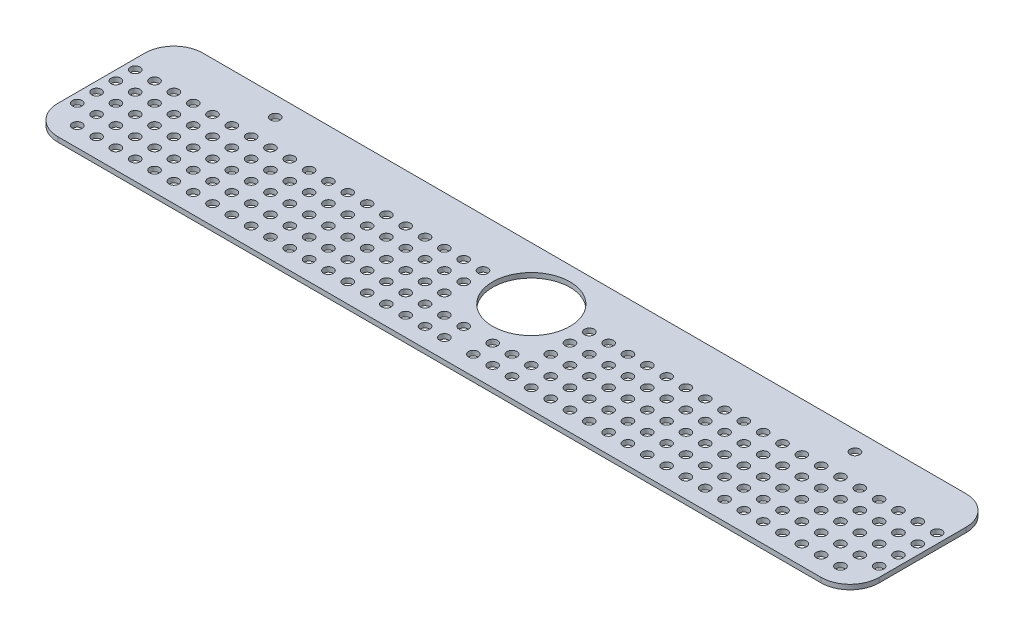
from build123d import *

# Parameters (mm, degrees)
SKETCH1_R           = 40
SKETCH1_R_2         = 5
BOSS_EXTRUDE1_DEPTH = 5


with BuildPart() as part:
    # Sketch1 → Boss-Extrude1 (new body)
    with BuildSketch(Plane(origin=(0, 0, 0), x_dir=(1, 0, 0), z_dir=(0, 1, 0))):
        with BuildLine():
            Line((395, -75), (-395, -75))
            ThreePointArc((-395, -75), (-416.213203436, -66.213203436), (-425, -45))
            Line((-425, -45), (-425, 45))
            ThreePointArc((-425, 45), (-416.213203436, 66.213203436), (-395, 75))
            Line((-395, 75), (395, 75))
            ThreePointArc((395, 75), (416.213203436, 66.213203436), (425, 45))
            Line((425, 45), (425, -45))
            ThreePointArc((425, -45), (416.213203436, -66.213203436), (395, -75))
        make_face()
        with Locations(Location((0, 20, 0), (0, 0, 270))):
            Circle(SKETCH1_R, mode=Mode.SUBTRACT)
        with Locations(Location((-300, 55, 0), (0, 0, 270))):
            Circle(SKETCH1_R_2, mode=Mode.SUBTRACT)
        with Locations(Location((300, 55, 0), (0, 0, 270))):
            Circle(SKETCH1_R_2, mode=Mode.SUBTRACT)
        with Locations(Location((-415, 25, 0), (0, 0, 270))):
            Circle(SKETCH1_R_2, mode=Mode.SUBTRACT)
        with Locations(Location((-395, 25, 0), (0, 0, 270))):
            Circle(SKETCH1_R_2, mode=Mode.SUBTRACT)
        with Locations(Location((-375, 25, 0), (0, 0, 270))):
            Circle(SKETCH1_R_2, mode=Mode.SUBTRACT)
        with Locations(Location((-355, 25, 0), (0, 0, 270))):
            Circle(SKETCH1_R_2, mode=Mode.SUBTRACT)
        with Locations(Location((-335, 25, 0), (0, 0, 270))):
            Circle(SKETCH1_R_2, mode=Mode.SUBTRACT)
        with Locations(Location((-315, 25, 0), (0, 0, 270))):
            Circle(SKETCH1_R_2, mode=Mode.SUBTRACT)
        with Locations(Location((-295, 25, 0), (0, 0, 270))):
            Circle(SKETCH1_R_2, mode=Mode.SUBTRACT)
        with Locations(Location((-275, 25, 0), (0, 0, 270))):
            Circle(SKETCH1_R_2, mode=Mode.SUBTRACT)
        with Locations(Location((-255, 25, 0), (0, 0, 270))):
            Circle(SKETCH1_R_2, mode=Mode.SUBTRACT)
        with Locations(Location((-235, 25, 0), (0, 0, 270))):
            Circle(SKETCH1_R_2, mode=Mode.SUBTRACT)
        with Locations(Location((-415, 5, 0), (0, 0, 270))):
            Circle(SKETCH1_R_2, mode=Mode.SUBTRACT)
        with Locations(Location((-395, 5, 0), (0, 0, 270))):
            Circle(SKETCH1_R_2, mode=Mode.SUBTRACT)
        with Locations(Location((-375, 5, 0), (0, 0, 270))):
            Circle(SKETCH1_R_2, mode=Mode.SUBTRACT)
        with Locations(Location((-355, 5, 0), (0, 0, 270))):
            Circle(SKETCH1_R_2, mode=Mode.SUBTRACT)
        with Locations(Location((-335, 5, 0), (0, 0, 270))):
            Circle(SKETCH1_R_2, mode=Mode.SUBTRACT)
        with Locations(Location((-315, 5, 0), (0, 0, 270))):
            Circle(SKETCH1_R_2, mode=Mode.SUBTRACT)
        with Locations(Location((-295, 5, 0), (0, 0, 270))):
            Circle(SKETCH1_R_2, mode=Mode.SUBTRACT)
        with Locations(Location((-275, 5, 0), (0, 0, 270))):
            Circle(SKETCH1_R_2, mode=Mode.SUBTRACT)
        with Locations(Location((-255, 5, 0), (0, 0, 270))):
            Circle(SKETCH1_R_2, mode=Mode.SUBTRACT)
        with Locations(Location((-235, 5, 0), (0, 0, 270))):
            Circle(SKETCH1_R_2, mode=Mode.SUBTRACT)
        with Locations(Location((-415, -15, 0), (0, 0, 270))):
            Circle(SKETCH1_R_2, mode=Mode.SUBTRACT)
        with Locations(Location((-395, -15, 0), (0, 0, 270))):
            Circle(SKETCH1_R_2, mode=Mode.SUBTRACT)
        with Locations(Location((-375, -15, 0), (0, 0, 270))):
            Circle(SKETCH1_R_2, mode=Mode.SUBTRACT)
        with Locations(Location((-355, -15, 0), (0, 0, 270))):
            Circle(SKETCH1_R_2, mode=Mode.SUBTRACT)
        with Locations(Location((-335, -15, 0), (0, 0, 270))):
            Circle(SKETCH1_R_2, mode=Mode.SUBTRACT)
        with Locations(Location((-315, -15, 0), (0, 0, 270))):
            Circle(SKETCH1_R_2, mode=Mode.SUBTRACT)
        with Locations(Location((-295, -15, 0), (0, 0, 270))):
            Circle(SKETCH1_R_2, mode=Mode.SUBTRACT)
        with Locations(Location((-275, -15, 0), (0, 0, 270))):
            Circle(SKETCH1_R_2, mode=Mode.SUBTRACT)
        with Locations(Location((-255, -15, 0), (0, 0, 270))):
            Circle(SKETCH1_R_2, mode=Mode.SUBTRACT)
        with Locations(Location((-235, -15, 0), (0, 0, 270))):
            Circle(SKETCH1_R_2, mode=Mode.SUBTRACT)
        with Locations(Location((-415, -35, 0), (0, 0, 270))):
            Circle(SKETCH1_R_2, mode=Mode.SUBTRACT)
        with Locations(Location((-395, -35, 0), (0, 0, 270))):
            Circle(SKETCH1_R_2, mode=Mode.SUBTRACT)
        with Locations(Location((-375, -35, 0), (0, 0, 270))):
            Circle(SKETCH1_R_2, mode=Mode.SUBTRACT)
        with Locations(Location((-355, -35, 0), (0, 0, 270))):
            Circle(SKETCH1_R_2, mode=Mode.SUBTRACT)
        with Locations(Location((-335, -35, 0), (0, 0, 270))):
            Circle(SKETCH1_R_2, mode=Mode.SUBTRACT)
        with Locations(Location((-315, -35, 0), (0, 0, 270))):
            Circle(SKETCH1_R_2, mode=Mode.SUBTRACT)
        with Locations(Location((-295, -35, 0), (0, 0, 270))):
            Circle(SKETCH1_R_2, mode=Mode.SUBTRACT)
        with Locations(Location((-275, -35, 0), (0, 0, 270))):
            Circle(SKETCH1_R_2, mode=Mode.SUBTRACT)
        with Locations(Location((-255, -35, 0), (0, 0, 270))):
            Circle(SKETCH1_R_2, mode=Mode.SUBTRACT)
        with Locations(Location((-235, -35, 0), (0, 0, 270))):
            Circle(SKETCH1_R_2, mode=Mode.SUBTRACT)
        with Locations(Location((-395, -55, 0), (0, 0, 270))):
            Circle(SKETCH1_R_2, mode=Mode.SUBTRACT)
        with Locations(Location((-375, -55, 0), (0, 0, 270))):
            Circle(SKETCH1_R_2, mode=Mode.SUBTRACT)
        with Locations(Location((-355, -55, 0), (0, 0, 270))):
            Circle(SKETCH1_R_2, mode=Mode.SUBTRACT)
        with Locations(Location((-335, -55, 0), (0, 0, 270))):
            Circle(SKETCH1_R_2, mode=Mode.SUBTRACT)
        with Locations(Location((-315, -55, 0), (0, 0, 270))):
            Circle(SKETCH1_R_2, mode=Mode.SUBTRACT)
        with Locations(Location((-295, -55, 0), (0, 0, 270))):
            Circle(SKETCH1_R_2, mode=Mode.SUBTRACT)
        with Locations(Location((-275, -55, 0), (0, 0, 270))):
            Circle(SKETCH1_R_2, mode=Mode.SUBTRACT)
        with Locations(Location((-255, -55, 0), (0, 0, 270))):
            Circle(SKETCH1_R_2, mode=Mode.SUBTRACT)
        with Locations(Location((-235, -55, 0), (0, 0, 270))):
            Circle(SKETCH1_R_2, mode=Mode.SUBTRACT)
        with Locations(Location((-215, -35, 0), (0, 0, 270))):
            Circle(SKETCH1_R_2, mode=Mode.SUBTRACT)
        with Locations(Location((-215, -55, 0), (0, 0, 270))):
            Circle(SKETCH1_R_2, mode=Mode.SUBTRACT)
        with Locations(Location((-195, -35, 0), (0, 0, 270))):
            Circle(SKETCH1_R_2, mode=Mode.SUBTRACT)
        with Locations(Location((-195, -55, 0), (0, 0, 270))):
            Circle(SKETCH1_R_2, mode=Mode.SUBTRACT)
        with Locations(Location((195, -55, 0), (0, 0, 270))):
            Circle(SKETCH1_R_2, mode=Mode.SUBTRACT)
        with Locations(Location((215, -55, 0), (0, 0, 270))):
            Circle(SKETCH1_R_2, mode=Mode.SUBTRACT)
        with Locations(Location((235, -55, 0), (0, 0, 270))):
            Circle(SKETCH1_R_2, mode=Mode.SUBTRACT)
        with Locations(Location((255, -55, 0), (0, 0, 270))):
            Circle(SKETCH1_R_2, mode=Mode.SUBTRACT)
        with Locations(Location((275, -55, 0), (0, 0, 270))):
            Circle(SKETCH1_R_2, mode=Mode.SUBTRACT)
        with Locations(Location((295, -55, 0), (0, 0, 270))):
            Circle(SKETCH1_R_2, mode=Mode.SUBTRACT)
        with Locations(Location((315, -55, 0), (0, 0, 270))):
            Circle(SKETCH1_R_2, mode=Mode.SUBTRACT)
        with Locations(Location((295, -35, 0), (0, 0, 270))):
            Circle(SKETCH1_R_2, mode=Mode.SUBTRACT)
        with Locations(Location((275, -35, 0), (0, 0, 270))):
            Circle(SKETCH1_R_2, mode=Mode.SUBTRACT)
        with Locations(Location((255, -35, 0), (0, 0, 270))):
            Circle(SKETCH1_R_2, mode=Mode.SUBTRACT)
        with Locations(Location((235, -35, 0), (0, 0, 270))):
            Circle(SKETCH1_R_2, mode=Mode.SUBTRACT)
        with Locations(Location((195, -35, 0), (0, 0, 270))):
            Circle(SKETCH1_R_2, mode=Mode.SUBTRACT)
        with Locations(Location((215, -35, 0), (0, 0, 270))):
            Circle(SKETCH1_R_2, mode=Mode.SUBTRACT)
        with Locations(Location((235, -15, 0), (0, 0, 270))):
            Circle(SKETCH1_R_2, mode=Mode.SUBTRACT)
        with Locations(Location((255, -15, 0), (0, 0, 270))):
            Circle(SKETCH1_R_2, mode=Mode.SUBTRACT)
        with Locations(Location((275, -15, 0), (0, 0, 270))):
            Circle(SKETCH1_R_2, mode=Mode.SUBTRACT)
        with Locations(Location((295, -15, 0), (0, 0, 270))):
            Circle(SKETCH1_R_2, mode=Mode.SUBTRACT)
        with Locations(Location((295, 5, 0), (0, 0, 270))):
            Circle(SKETCH1_R_2, mode=Mode.SUBTRACT)
        with Locations(Location((275, 5, 0), (0, 0, 270))):
            Circle(SKETCH1_R_2, mode=Mode.SUBTRACT)
        with Locations(Location((255, 5, 0), (0, 0, 270))):
            Circle(SKETCH1_R_2, mode=Mode.SUBTRACT)
        with Locations(Location((235, 5, 0), (0, 0, 270))):
            Circle(SKETCH1_R_2, mode=Mode.SUBTRACT)
        with Locations(Location((235, 25, 0), (0, 0, 270))):
            Circle(SKETCH1_R_2, mode=Mode.SUBTRACT)
        with Locations(Location((255, 25, 0), (0, 0, 270))):
            Circle(SKETCH1_R_2, mode=Mode.SUBTRACT)
        with Locations(Location((275, 25, 0), (0, 0, 270))):
            Circle(SKETCH1_R_2, mode=Mode.SUBTRACT)
        with Locations(Location((295, 25, 0), (0, 0, 270))):
            Circle(SKETCH1_R_2, mode=Mode.SUBTRACT)
        with Locations(Location((315, 25, 0), (0, 0, 270))):
            Circle(SKETCH1_R_2, mode=Mode.SUBTRACT)
        with Locations(Location((315, 5, 0), (0, 0, 270))):
            Circle(SKETCH1_R_2, mode=Mode.SUBTRACT)
        with Locations(Location((315, -15, 0), (0, 0, 270))):
            Circle(SKETCH1_R_2, mode=Mode.SUBTRACT)
        with Locations(Location((315, -35, 0), (0, 0, 270))):
            Circle(SKETCH1_R_2, mode=Mode.SUBTRACT)
        with Locations(Location((335, -55, 0), (0, 0, 270))):
            Circle(SKETCH1_R_2, mode=Mode.SUBTRACT)
        with Locations(Location((335, 5, 0), (0, 0, 270))):
            Circle(SKETCH1_R_2, mode=Mode.SUBTRACT)
        with Locations(Location((335, -15, 0), (0, 0, 270))):
            Circle(SKETCH1_R_2, mode=Mode.SUBTRACT)
        with Locations(Location((335, -35, 0), (0, 0, 270))):
            Circle(SKETCH1_R_2, mode=Mode.SUBTRACT)
        with Locations(Location((355, -55, 0), (0, 0, 270))):
            Circle(SKETCH1_R_2, mode=Mode.SUBTRACT)
        with Locations(Location((355, -35, 0), (0, 0, 270))):
            Circle(SKETCH1_R_2, mode=Mode.SUBTRACT)
        with Locations(Location((355, -15, 0), (0, 0, 270))):
            Circle(SKETCH1_R_2, mode=Mode.SUBTRACT)
        with Locations(Location((355, 5, 0), (0, 0, 270))):
            Circle(SKETCH1_R_2, mode=Mode.SUBTRACT)
        with Locations(Location((335, 25, 0), (0, 0, 270))):
            Circle(SKETCH1_R_2, mode=Mode.SUBTRACT)
        with Locations(Location((355, 25, 0), (0, 0, 270))):
            Circle(SKETCH1_R_2, mode=Mode.SUBTRACT)
        with Locations(Location((375, -55, 0), (0, 0, 270))):
            Circle(SKETCH1_R_2, mode=Mode.SUBTRACT)
        with Locations(Location((375, -15, 0), (0, 0, 270))):
            Circle(SKETCH1_R_2, mode=Mode.SUBTRACT)
        with Locations(Location((375, -35, 0), (0, 0, 270))):
            Circle(SKETCH1_R_2, mode=Mode.SUBTRACT)
        with Locations(Location((395, -55, 0), (0, 0, 270))):
            Circle(SKETCH1_R_2, mode=Mode.SUBTRACT)
        with Locations(Location((395, -35, 0), (0, 0, 270))):
            Circle(SKETCH1_R_2, mode=Mode.SUBTRACT)
        with Locations(Location((395, -15, 0), (0, 0, 270))):
            Circle(SKETCH1_R_2, mode=Mode.SUBTRACT)
        with Locations(Location((415, -35, 0), (0, 0, 270))):
            Circle(SKETCH1_R_2, mode=Mode.SUBTRACT)
        with Locations(Location((415, -15, 0), (0, 0, 270))):
            Circle(SKETCH1_R_2, mode=Mode.SUBTRACT)
        with Locations(Location((415, 5, 0), (0, 0, 270))):
            Circle(SKETCH1_R_2, mode=Mode.SUBTRACT)
        with Locations(Location((395, 5, 0), (0, 0, 270))):
            Circle(SKETCH1_R_2, mode=Mode.SUBTRACT)
        with Locations(Location((375, 5, 0), (0, 0, 270))):
            Circle(SKETCH1_R_2, mode=Mode.SUBTRACT)
        with Locations(Location((375, 25, 0), (0, 0, 270))):
            Circle(SKETCH1_R_2, mode=Mode.SUBTRACT)
        with Locations(Location((395, 25, 0), (0, 0, 270))):
            Circle(SKETCH1_R_2, mode=Mode.SUBTRACT)
        with Locations(Location((415, 25, 0), (0, 0, 270))):
            Circle(SKETCH1_R_2, mode=Mode.SUBTRACT)
        with Locations(Location((-215, 25, 0), (0, 0, 270))):
            Circle(SKETCH1_R_2, mode=Mode.SUBTRACT)
        with Locations(Location((-215, 5, 0), (0, 0, 270))):
            Circle(SKETCH1_R_2, mode=Mode.SUBTRACT)
        with Locations(Location((-215, -15, 0), (0, 0, 270))):
            Circle(SKETCH1_R_2, mode=Mode.SUBTRACT)
        with Locations(Location((-175, -35, 0), (0, 0, 270))):
            Circle(SKETCH1_R_2, mode=Mode.SUBTRACT)
        with Locations(Location((-175, -55, 0), (0, 0, 270))):
            Circle(SKETCH1_R_2, mode=Mode.SUBTRACT)
        with Locations(Location((-195, 25, 0), (0, 0, 270))):
            Circle(SKETCH1_R_2, mode=Mode.SUBTRACT)
        with Locations(Location((-195, 5, 0), (0, 0, 270))):
            Circle(SKETCH1_R_2, mode=Mode.SUBTRACT)
        with Locations(Location((-195, -15, 0), (0, 0, 270))):
            Circle(SKETCH1_R_2, mode=Mode.SUBTRACT)
        with Locations(Location((-155, -35, 0), (0, 0, 270))):
            Circle(SKETCH1_R_2, mode=Mode.SUBTRACT)
        with Locations(Location((-155, -55, 0), (0, 0, 270))):
            Circle(SKETCH1_R_2, mode=Mode.SUBTRACT)
        with Locations(Location((-175, 25, 0), (0, 0, 270))):
            Circle(SKETCH1_R_2, mode=Mode.SUBTRACT)
        with Locations(Location((-175, 5, 0), (0, 0, 270))):
            Circle(SKETCH1_R_2, mode=Mode.SUBTRACT)
        with Locations(Location((-175, -15, 0), (0, 0, 270))):
            Circle(SKETCH1_R_2, mode=Mode.SUBTRACT)
        with Locations(Location((-135, -35, 0), (0, 0, 270))):
            Circle(SKETCH1_R_2, mode=Mode.SUBTRACT)
        with Locations(Location((-135, -55, 0), (0, 0, 270))):
            Circle(SKETCH1_R_2, mode=Mode.SUBTRACT)
        with Locations(Location((-155, 25, 0), (0, 0, 270))):
            Circle(SKETCH1_R_2, mode=Mode.SUBTRACT)
        with Locations(Location((-155, 5, 0), (0, 0, 270))):
            Circle(SKETCH1_R_2, mode=Mode.SUBTRACT)
        with Locations(Location((-155, -15, 0), (0, 0, 270))):
            Circle(SKETCH1_R_2, mode=Mode.SUBTRACT)
        with Locations(Location((-115, -35, 0), (0, 0, 270))):
            Circle(SKETCH1_R_2, mode=Mode.SUBTRACT)
        with Locations(Location((-115, -55, 0), (0, 0, 270))):
            Circle(SKETCH1_R_2, mode=Mode.SUBTRACT)
        with Locations(Location((-135, 25, 0), (0, 0, 270))):
            Circle(SKETCH1_R_2, mode=Mode.SUBTRACT)
        with Locations(Location((-135, 5, 0), (0, 0, 270))):
            Circle(SKETCH1_R_2, mode=Mode.SUBTRACT)
        with Locations(Location((-135, -15, 0), (0, 0, 270))):
            Circle(SKETCH1_R_2, mode=Mode.SUBTRACT)
        with Locations(Location((-95, -35, 0), (0, 0, 270))):
            Circle(SKETCH1_R_2, mode=Mode.SUBTRACT)
        with Locations(Location((-95, -55, 0), (0, 0, 270))):
            Circle(SKETCH1_R_2, mode=Mode.SUBTRACT)
        with Locations(Location((-115, 25, 0), (0, 0, 270))):
            Circle(SKETCH1_R_2, mode=Mode.SUBTRACT)
        with Locations(Location((-115, 5, 0), (0, 0, 270))):
            Circle(SKETCH1_R_2, mode=Mode.SUBTRACT)
        with Locations(Location((-115, -15, 0), (0, 0, 270))):
            Circle(SKETCH1_R_2, mode=Mode.SUBTRACT)
        with Locations(Location((-75, -35, 0), (0, 0, 270))):
            Circle(SKETCH1_R_2, mode=Mode.SUBTRACT)
        with Locations(Location((-75, -55, 0), (0, 0, 270))):
            Circle(SKETCH1_R_2, mode=Mode.SUBTRACT)
        with Locations(Location((-95, 25, 0), (0, 0, 270))):
            Circle(SKETCH1_R_2, mode=Mode.SUBTRACT)
        with Locations(Location((-95, 5, 0), (0, 0, 270))):
            Circle(SKETCH1_R_2, mode=Mode.SUBTRACT)
        with Locations(Location((-95, -15, 0), (0, 0, 270))):
            Circle(SKETCH1_R_2, mode=Mode.SUBTRACT)
        with Locations(Location((-55, -35, 0), (0, 0, 270))):
            Circle(SKETCH1_R_2, mode=Mode.SUBTRACT)
        with Locations(Location((-55, -55, 0), (0, 0, 270))):
            Circle(SKETCH1_R_2, mode=Mode.SUBTRACT)
        with Locations(Location((-75, 25, 0), (0, 0, 270))):
            Circle(SKETCH1_R_2, mode=Mode.SUBTRACT)
        with Locations(Location((-75, 5, 0), (0, 0, 270))):
            Circle(SKETCH1_R_2, mode=Mode.SUBTRACT)
        with Locations(Location((-75, -15, 0), (0, 0, 270))):
            Circle(SKETCH1_R_2, mode=Mode.SUBTRACT)
        with Locations(Location((-35, -35, 0), (0, 0, 270))):
            Circle(SKETCH1_R_2, mode=Mode.SUBTRACT)
        with Locations(Location((-35, -55, 0), (0, 0, 270))):
            Circle(SKETCH1_R_2, mode=Mode.SUBTRACT)
        with Locations(Location((-55, 25, 0), (0, 0, 270))):
            Circle(SKETCH1_R_2, mode=Mode.SUBTRACT)
        with Locations(Location((-55, 5, 0), (0, 0, 270))):
            Circle(SKETCH1_R_2, mode=Mode.SUBTRACT)
        with Locations(Location((-55, -15, 0), (0, 0, 270))):
            Circle(SKETCH1_R_2, mode=Mode.SUBTRACT)
        with Locations(Location((-15, -35, 0), (0, 0, 270))):
            Circle(SKETCH1_R_2, mode=Mode.SUBTRACT)
        with Locations(Location((-15, -55, 0), (0, 0, 270))):
            Circle(SKETCH1_R_2, mode=Mode.SUBTRACT)
        with Locations(Location((215, 25, 0), (0, 0, 270))):
            Circle(SKETCH1_R_2, mode=Mode.SUBTRACT)
        with Locations(Location((215, 5, 0), (0, 0, 270))):
            Circle(SKETCH1_R_2, mode=Mode.SUBTRACT)
        with Locations(Location((215, -15, 0), (0, 0, 270))):
            Circle(SKETCH1_R_2, mode=Mode.SUBTRACT)
        with Locations(Location((175, -35, 0), (0, 0, 270))):
            Circle(SKETCH1_R_2, mode=Mode.SUBTRACT)
        with Locations(Location((175, -55, 0), (0, 0, 270))):
            Circle(SKETCH1_R_2, mode=Mode.SUBTRACT)
        with Locations(Location((195, 25, 0), (0, 0, 270))):
            Circle(SKETCH1_R_2, mode=Mode.SUBTRACT)
        with Locations(Location((195, 5, 0), (0, 0, 270))):
            Circle(SKETCH1_R_2, mode=Mode.SUBTRACT)
        with Locations(Location((195, -15, 0), (0, 0, 270))):
            Circle(SKETCH1_R_2, mode=Mode.SUBTRACT)
        with Locations(Location((155, -35, 0), (0, 0, 270))):
            Circle(SKETCH1_R_2, mode=Mode.SUBTRACT)
        with Locations(Location((155, -55, 0), (0, 0, 270))):
            Circle(SKETCH1_R_2, mode=Mode.SUBTRACT)
        with Locations(Location((175, 25, 0), (0, 0, 270))):
            Circle(SKETCH1_R_2, mode=Mode.SUBTRACT)
        with Locations(Location((175, 5, 0), (0, 0, 270))):
            Circle(SKETCH1_R_2, mode=Mode.SUBTRACT)
        with Locations(Location((175, -15, 0), (0, 0, 270))):
            Circle(SKETCH1_R_2, mode=Mode.SUBTRACT)
        with Locations(Location((135, -35, 0), (0, 0, 270))):
            Circle(SKETCH1_R_2, mode=Mode.SUBTRACT)
        with Locations(Location((135, -55, 0), (0, 0, 270))):
            Circle(SKETCH1_R_2, mode=Mode.SUBTRACT)
        with Locations(Location((155, 25, 0), (0, 0, 270))):
            Circle(SKETCH1_R_2, mode=Mode.SUBTRACT)
        with Locations(Location((155, 5, 0), (0, 0, 270))):
            Circle(SKETCH1_R_2, mode=Mode.SUBTRACT)
        with Locations(Location((155, -15, 0), (0, 0, 270))):
            Circle(SKETCH1_R_2, mode=Mode.SUBTRACT)
        with Locations(Location((115, -35, 0), (0, 0, 270))):
            Circle(SKETCH1_R_2, mode=Mode.SUBTRACT)
        with Locations(Location((115, -55, 0), (0, 0, 270))):
            Circle(SKETCH1_R_2, mode=Mode.SUBTRACT)
        with Locations(Location((135, 25, 0), (0, 0, 270))):
            Circle(SKETCH1_R_2, mode=Mode.SUBTRACT)
        with Locations(Location((135, 5, 0), (0, 0, 270))):
            Circle(SKETCH1_R_2, mode=Mode.SUBTRACT)
        with Locations(Location((135, -15, 0), (0, 0, 270))):
            Circle(SKETCH1_R_2, mode=Mode.SUBTRACT)
        with Locations(Location((95, -35, 0), (0, 0, 270))):
            Circle(SKETCH1_R_2, mode=Mode.SUBTRACT)
        with Locations(Location((95, -55, 0), (0, 0, 270))):
            Circle(SKETCH1_R_2, mode=Mode.SUBTRACT)
        with Locations(Location((115, 25, 0), (0, 0, 270))):
            Circle(SKETCH1_R_2, mode=Mode.SUBTRACT)
        with Locations(Location((115, 5, 0), (0, 0, 270))):
            Circle(SKETCH1_R_2, mode=Mode.SUBTRACT)
        with Locations(Location((115, -15, 0), (0, 0, 270))):
            Circle(SKETCH1_R_2, mode=Mode.SUBTRACT)
        with Locations(Location((75, -35, 0), (0, 0, 270))):
            Circle(SKETCH1_R_2, mode=Mode.SUBTRACT)
        with Locations(Location((75, -55, 0), (0, 0, 270))):
            Circle(SKETCH1_R_2, mode=Mode.SUBTRACT)
        with Locations(Location((95, 25, 0), (0, 0, 270))):
            Circle(SKETCH1_R_2, mode=Mode.SUBTRACT)
        with Locations(Location((95, 5, 0), (0, 0, 270))):
            Circle(SKETCH1_R_2, mode=Mode.SUBTRACT)
        with Locations(Location((95, -15, 0), (0, 0, 270))):
            Circle(SKETCH1_R_2, mode=Mode.SUBTRACT)
        with Locations(Location((55, -35, 0), (0, 0, 270))):
            Circle(SKETCH1_R_2, mode=Mode.SUBTRACT)
        with Locations(Location((55, -55, 0), (0, 0, 270))):
            Circle(SKETCH1_R_2, mode=Mode.SUBTRACT)
        with Locations(Location((75, 25, 0), (0, 0, 270))):
            Circle(SKETCH1_R_2, mode=Mode.SUBTRACT)
        with Locations(Location((75, 5, 0), (0, 0, 270))):
            Circle(SKETCH1_R_2, mode=Mode.SUBTRACT)
        with Locations(Location((75, -15, 0), (0, 0, 270))):
            Circle(SKETCH1_R_2, mode=Mode.SUBTRACT)
        with Locations(Location((35, -35, 0), (0, 0, 270))):
            Circle(SKETCH1_R_2, mode=Mode.SUBTRACT)
        with Locations(Location((35, -55, 0), (0, 0, 270))):
            Circle(SKETCH1_R_2, mode=Mode.SUBTRACT)
        with Locations(Location((55, 25, 0), (0, 0, 270))):
            Circle(SKETCH1_R_2, mode=Mode.SUBTRACT)
        with Locations(Location((55, 5, 0), (0, 0, 270))):
            Circle(SKETCH1_R_2, mode=Mode.SUBTRACT)
        with Locations(Location((55, -15, 0), (0, 0, 270))):
            Circle(SKETCH1_R_2, mode=Mode.SUBTRACT)
        with Locations(Location((15, -35, 0), (0, 0, 270))):
            Circle(SKETCH1_R_2, mode=Mode.SUBTRACT)
        with Locations(Location((15, -55, 0), (0, 0, 270))):
            Circle(SKETCH1_R_2, mode=Mode.SUBTRACT)
    extrude(amount=BOSS_EXTRUDE1_DEPTH)


solid = part.part
